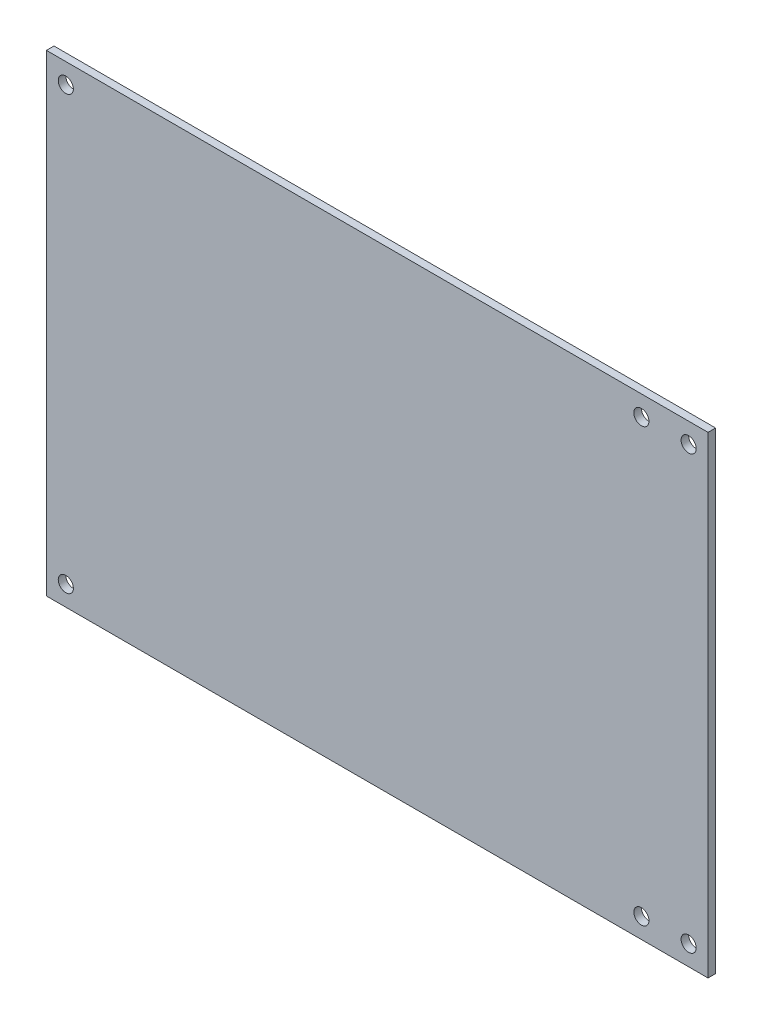
from build123d import *

# Parameters (mm, degrees)
SKETCH_1_W          = 140
SKETCH_1_H          = 100
EXTRUDE_1_DEPTH     = 1.6
SKETCH_2_R          = 1.6
CUT_EXTRUDE_1_DEPTH = 87.038131082


with BuildPart() as part:
    # Эскиз1 → Бобышка-Вытянуть1 (new body)
    with BuildSketch(Plane.XY):
        Rectangle(SKETCH_1_W, SKETCH_1_H)
    extrude(amount=EXTRUDE_1_DEPTH)

    # Эскиз2 → Вырез-Вытянуть1 (cut, through all)
    with BuildSketch(Plane.XY.offset(1.6)):
        with Locations((-65.9, 45.75)):
            Circle(SKETCH_2_R)
        with Locations(Location((65.9, 45.75, 0), (0, 0, 180))):
            Circle(SKETCH_2_R)
        with Locations((65.9, -45.75)):
            Circle(SKETCH_2_R)
        with Locations(Location((-65.9, -45.75, 0), (0, 0, 180))):
            Circle(SKETCH_2_R)
        with Locations(Location((55.9, 45.75, 0), (0, 0, 180))):
            Circle(SKETCH_2_R)
        with Locations((55.9, -45.75)):
            Circle(SKETCH_2_R)
    extrude(amount=-CUT_EXTRUDE_1_DEPTH, mode=Mode.SUBTRACT)


solid = part.part
